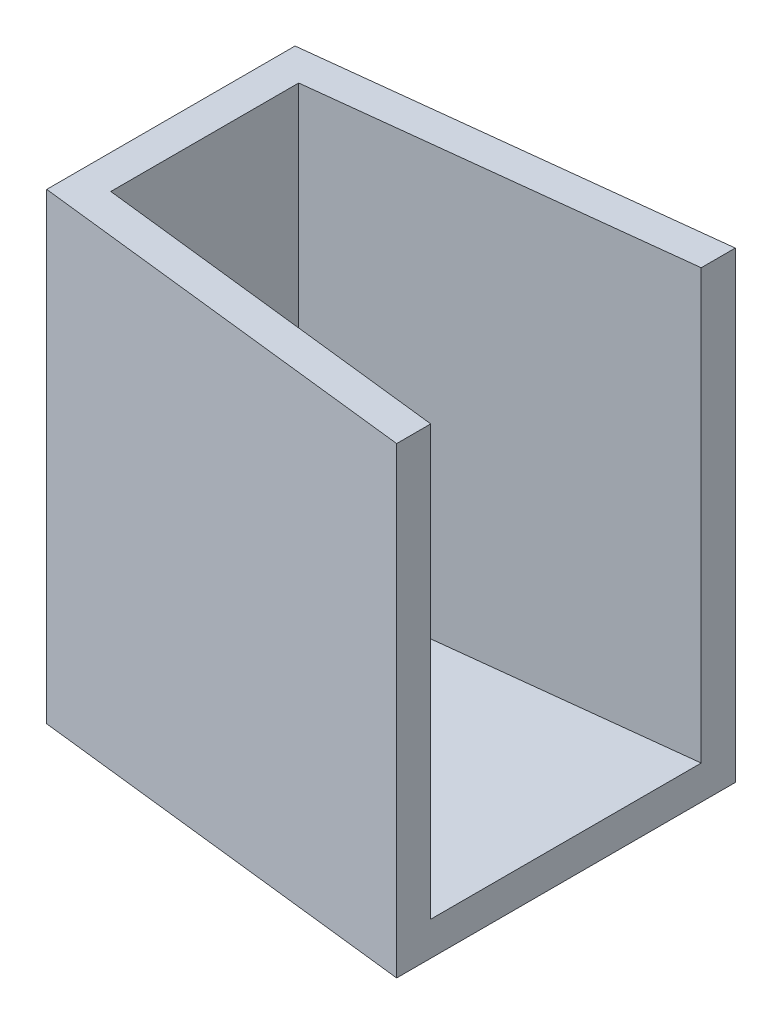
from build123d import *

# Parameters (mm, degrees)
BOSS_EXTRUDE1_DEPTH = 3
BOSS_EXTRUDE3_DEPTH = 38


with BuildPart() as part:
    # Sketch1 → Boss-Extrude1 (new body)
    with BuildSketch(Plane(origin=(0, 0, 0), x_dir=(1, 0, 0), z_dir=(0, 1, 0))):
        Polygon((-35, 0), (0, 0), (0, 15), (-35, 11), align=None)
        Polygon((-35, -11), (0, -15), (0, 0), (-35, 0), align=None)
    extrude(amount=BOSS_EXTRUDE1_DEPTH)

    # Sketch2 → Boss-Extrude3 (add)
    with BuildSketch(Plane(origin=(0, 3, 0), x_dir=(1, 0, 0), z_dir=(0, 1, 0))):
        Polygon((-35, 11), (-35, -11), (0, -15), (0, -11.980471722), (-32, -8.323328865), (-32, 8.323328865), (0, 11.980471722), (0, 15), align=None)
    extrude(amount=BOSS_EXTRUDE3_DEPTH)


solid = part.part
